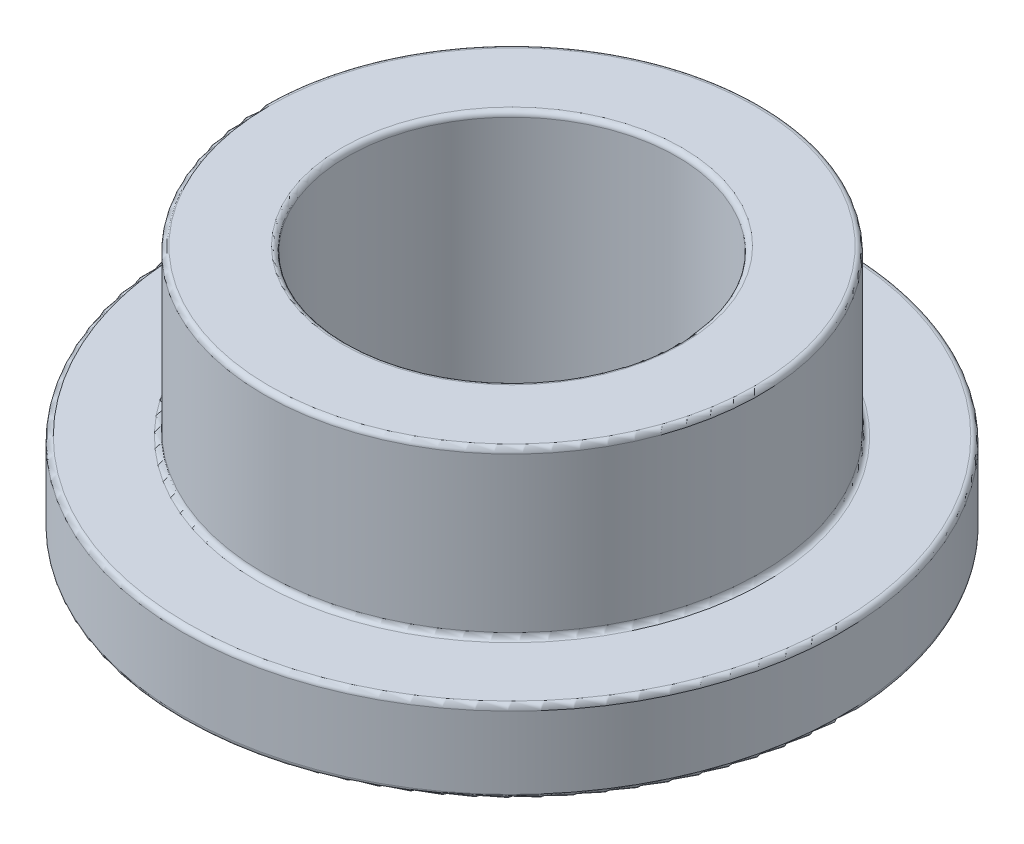
from build123d import *

# Parameters (mm, degrees)
SKETCH3_R           = 6.015
SKETCH3_R_2         = 4.005
BOSS_EXTRUDE1_DEPTH = 6
SKETCH4_R           = 8
SKETCH4_R_2         = 6.015
BOSS_EXTRUDE2_DEPTH = 2
FILLET1_R           = 0.125


with BuildPart() as part:
    # Sketch3 → Boss-Extrude1 (new body)
    with BuildSketch(Plane(origin=(0, 0, 0), x_dir=(1, 0, 0), z_dir=(0, 1, 0))):
        with Locations(Location((0, 0, 0), (0, 0, 270))):
            Circle(SKETCH3_R)
        with Locations(Location((0, 0, 0), (0, 0, 270))):
            Circle(SKETCH3_R_2, mode=Mode.SUBTRACT)
    extrude(amount=BOSS_EXTRUDE1_DEPTH)

    # Sketch4 → Boss-Extrude2 (add)
    with BuildSketch(Plane(origin=(0, 0, 0), x_dir=(1, 0, 0), z_dir=(0, 1, 0))):
        with Locations(Location((0, 0, 0), (0, 0, 270))):
            Circle(SKETCH4_R)
        with Locations(Location((0, 0, 0), (0, 0, 270))):
            Circle(SKETCH4_R_2, mode=Mode.SUBTRACT)
    extrude(amount=BOSS_EXTRUDE2_DEPTH)

    # Fillet1
    fillet1_edges = [part.edges().sort_by_distance(p)[0] for p in [
        (0, 0, -8),
        (0, 2, -6.015),
        (0, 6, -6.015),
        (0, 0, -4.005),
        (0, 6, -4.005),
        (0, 2, -8),
    ]]
    fillet(fillet1_edges, radius=FILLET1_R)


solid = part.part
